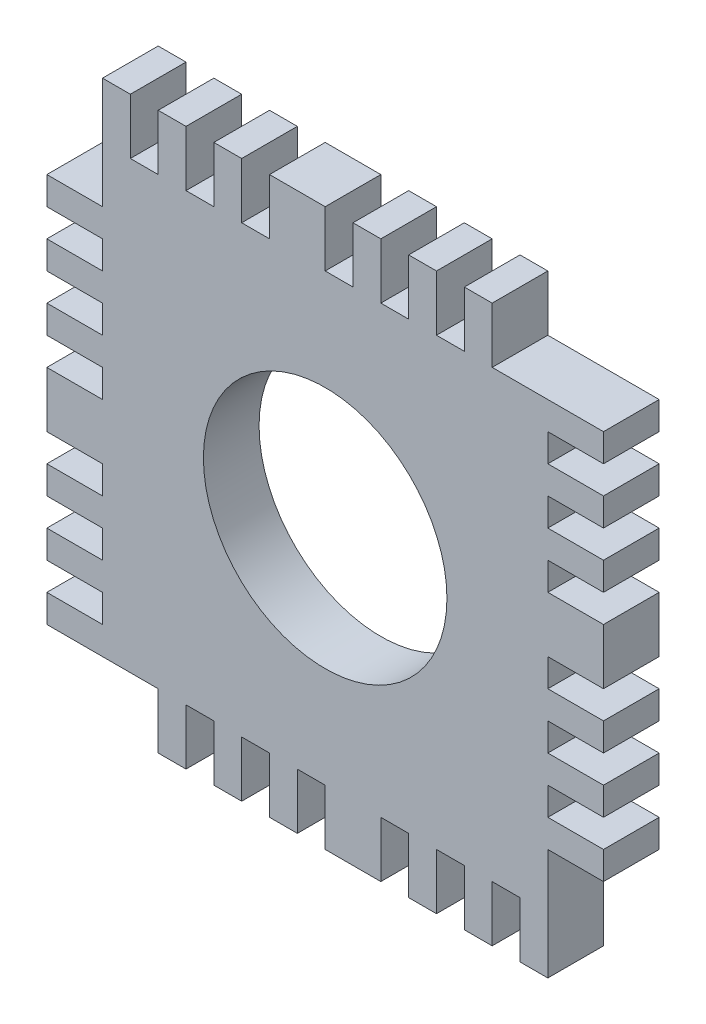
from build123d import *

# Parameters (mm, degrees)
BOSS_EXTRU_1_DEPTH      = 8
ESQUISSE2_R             = 17.5
ENL_V_MAT_EXTRU_1_DEPTH = 58.131427428


with BuildPart() as part:
    # Esquisse1 → Boss.-Extru.1 (new body)
    with BuildSketch(Plane.XY):
        Polygon((40, 28), (40, 32), (24, 32), (24, 40), (20, 40), (20, 32), (16, 32), (16, 40), (12, 40), (12, 32), (8, 32), (8, 40), (4, 40), (4, 32), (0, 32), (0, 40), (-8, 40), (-8, 32), (-12, 32), (-12, 40), (-16, 40), (-16, 32), (-20, 32), (-20, 40), (-24, 40), (-24, 32), (-28, 32), (-28, 40), (-32, 40), (-32, 24), (-40, 24), (-40, 20), (-32, 20), (-32, 16), (-40, 16), (-40, 12), (-32, 12), (-32, 8), (-40, 8), (-40, 4), (-32, 4), (-32, 0), (-40, 0), (-40, -8), (-32, -8), (-32, -12), (-40, -12), (-40, -16), (-32, -16), (-32, -20), (-40, -20), (-40, -24), (-32, -24), (-32, -28), (-40, -28), (-40, -32), (-24, -32), (-24, -40), (-20, -40), (-20, -32), (-16, -32), (-16, -40), (-12, -40), (-12, -32), (-8, -32), (-8, -40), (-4, -40), (-4, -32), (0, -32), (0, -40), (8, -40), (8, -32), (12, -32), (12, -40), (16, -40), (16, -32), (20, -32), (20, -40), (24, -40), (24, -32), (28, -32), (28, -40), (32, -40), (32, -24), (40, -24), (40, -20), (32, -20), (32, -16), (40, -16), (40, -12), (32, -12), (32, -8), (40, -8), (40, -4), (32, -4), (32, 0), (40, 0), (40, 8), (32, 8), (32, 12), (40, 12), (40, 16), (32, 16), (32, 20), (40, 20), (40, 24), (32, 24), (32, 28), align=None)
    extrude(amount=BOSS_EXTRU_1_DEPTH)

    # Esquisse2 → Enlèv. mat.-Extru.1 (cut, through all)
    with BuildSketch(Plane.XY):
        Circle(ESQUISSE2_R)
    extrude(amount=ENL_V_MAT_EXTRU_1_DEPTH, mode=Mode.SUBTRACT)


solid = part.part
